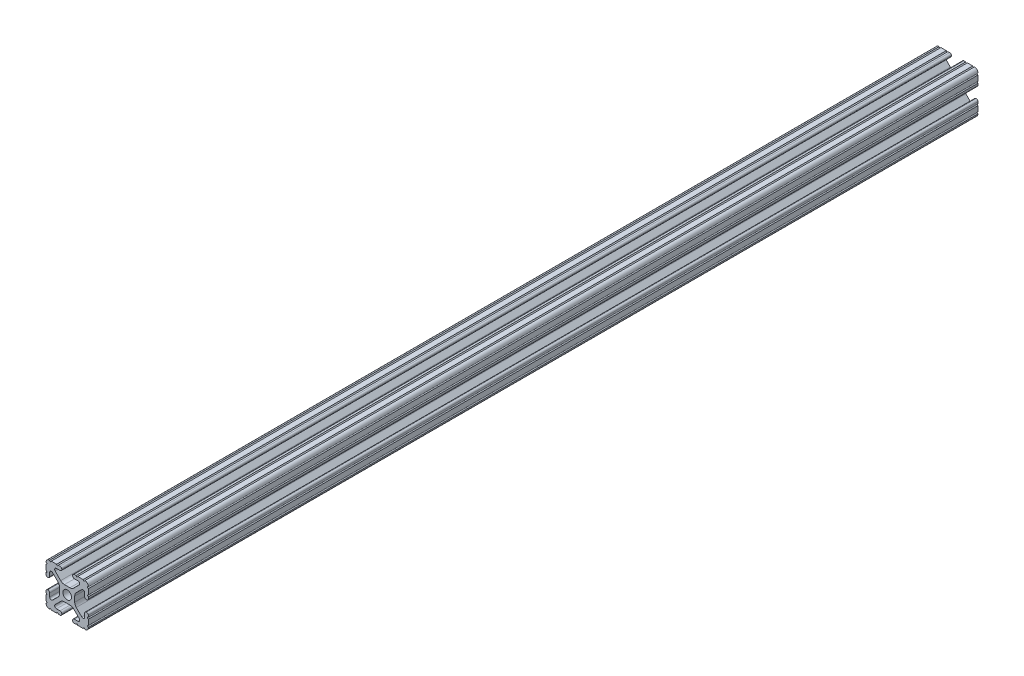
from build123d import *

# Parameters (mm, degrees)
SKETCH1_R      = 2.6035
EXTRUDE1_DEPTH = 533.4


with BuildPart() as part:
    # Sketch1 → Extrude1 (new body)
    with BuildSketch(Plane.XY):
        with BuildLine():
            Line((-7.207036008, 8.724370562), (-3.898272566, 5.423169045))
            ThreePointArc((-3.898272566, 5.423169045), (-2.869120213, 4.736787962), (-1.655778399, 4.4958))
            Line((-1.655778399, 4.4958), (1.655778399, 4.4958))
            ThreePointArc((1.655778399, 4.4958), (2.869120213, 4.736787962), (3.898272566, 5.423169045))
            Line((3.898272566, 5.423169045), (7.207036008, 8.724370562))
            ThreePointArc((7.207036008, 8.724370562), (7.432222385, 9.85140422), (6.476788598, 10.4902))
            Line((6.476788598, 10.4902), (4.287512407, 10.4902))
            ThreePointArc((4.287512407, 10.4902), (3.54574862, 10.79744862), (3.2385, 11.539212407))
            Line((3.2385, 11.539212407), (3.2385, 11.650987593))
            ThreePointArc((3.2385, 11.650987593), (3.54574862, 12.39275138), (4.287512407, 12.7))
            Line((4.287512407, 12.7), (5.317126718, 12.7))
            ThreePointArc((5.317126718, 12.7), (5.825126718, 12.192), (6.333126718, 12.7))
            Line((6.333126718, 12.7), (9.550443118, 12.7))
            ThreePointArc((9.550443118, 12.7), (10.058366869, 12.192000006), (10.566443095, 12.699847501))
            ThreePointArc((10.566443095, 12.699847501), (12.082537762, 12.08250727), (12.699846982, 10.566399977))
            ThreePointArc((12.699846982, 10.566399977), (12.192000006, 10.058323491), (12.7, 9.5504))
            Line((12.7, 9.5504), (12.7, 6.3330836))
            ThreePointArc((12.7, 6.3330836), (12.192, 5.8250836), (12.7, 5.3170836))
            Line((12.7, 5.3170836), (12.7, 4.287469289))
            ThreePointArc((12.7, 4.287469289), (12.39275138, 3.545705502), (11.650987593, 3.238456882))
            Line((11.650987593, 3.238456882), (11.539212407, 3.238456882))
            ThreePointArc((11.539212407, 3.238456882), (10.79744862, 3.545705502), (10.4902, 4.287469289))
            Line((10.4902, 4.287469289), (10.4902, 6.402089023))
            ThreePointArc((10.4902, 6.402089023), (9.856505071, 7.351067942), (8.737131347, 7.129408934))
            Line((8.737131347, 7.129408934), (5.441005833, 3.840816462))
            ThreePointArc((5.441005833, 3.840816462), (4.750877967, 2.809883091), (4.5085, 1.593185507))
            Line((4.5085, 1.593185507), (4.5085, -1.593185507))
            ThreePointArc((4.5085, -1.593185507), (4.750877967, -2.809883091), (5.441005833, -3.840816462))
            Line((5.441005833, -3.840816462), (8.737131347, -7.129408934))
            ThreePointArc((8.737131347, -7.129408934), (9.856505071, -7.351067942), (10.4902, -6.402089023))
            Line((10.4902, -6.402089023), (10.4902, -4.287469289))
            ThreePointArc((10.4902, -4.287469289), (10.79744862, -3.545705502), (11.539212407, -3.238456882))
            Line((11.539212407, -3.238456882), (11.650987593, -3.238456882))
            ThreePointArc((11.650987593, -3.238456882), (12.39275138, -3.545705502), (12.7, -4.287469289))
            Line((12.7, -4.287469289), (12.7, -5.3170836))
            ThreePointArc((12.7, -5.3170836), (12.192, -5.8250836), (12.7, -6.3330836))
            Line((12.7, -6.3330836), (12.7, -9.5504))
            ThreePointArc((12.7, -9.5504), (12.192000006, -10.058323491), (12.699846982, -10.566399977))
            ThreePointArc((12.699846982, -10.566399977), (12.082537762, -12.08250727), (10.566443095, -12.699847501))
            ThreePointArc((10.566443095, -12.699847501), (10.058366869, -12.192000006), (9.550443118, -12.7))
            Line((9.550443118, -12.7), (6.333126718, -12.7))
            ThreePointArc((6.333126718, -12.7), (5.825126718, -12.192), (5.317126718, -12.7))
            Line((5.317126718, -12.7), (4.287512407, -12.7))
            ThreePointArc((4.287512407, -12.7), (3.54574862, -12.39275138), (3.2385, -11.650987593))
            Line((3.2385, -11.650987593), (3.2385, -11.539212407))
            ThreePointArc((3.2385, -11.539212407), (3.54574862, -10.79744862), (4.287512407, -10.4902))
            Line((4.287512407, -10.4902), (6.416408329, -10.4902))
            ThreePointArc((6.416408329, -10.4902), (7.41473083, -9.822813117), (7.179650497, -8.645192506))
            Line((7.179650497, -8.645192506), (3.952270251, -5.423690499))
            ThreePointArc((3.952270251, -5.423690499), (2.922936451, -4.736929036), (1.709253557, -4.4958))
            Line((1.709253557, -4.4958), (-1.709253557, -4.4958))
            ThreePointArc((-1.709253557, -4.4958), (-2.922936451, -4.736929036), (-3.952270251, -5.423690499))
            Line((-3.952270251, -5.423690499), (-7.179650497, -8.645192506))
            ThreePointArc((-7.179650497, -8.645192506), (-7.41473083, -9.822813117), (-6.416408329, -10.4902))
            Line((-6.416408329, -10.4902), (-4.287512407, -10.4902))
            ThreePointArc((-4.287512407, -10.4902), (-3.54574862, -10.79744862), (-3.2385, -11.539212407))
            Line((-3.2385, -11.539212407), (-3.2385, -11.650987593))
            ThreePointArc((-3.2385, -11.650987593), (-3.54574862, -12.39275138), (-4.287512407, -12.7))
            Line((-4.287512407, -12.7), (-5.317126718, -12.7))
            ThreePointArc((-5.317126718, -12.7), (-5.825126718, -12.192), (-6.333126718, -12.7))
            Line((-6.333126718, -12.7), (-9.550443118, -12.7))
            ThreePointArc((-9.550443118, -12.7), (-10.058366869, -12.192000006), (-10.566443095, -12.699847501))
            ThreePointArc((-10.566443095, -12.699847501), (-12.082537762, -12.08250727), (-12.699846982, -10.566399977))
            ThreePointArc((-12.699846982, -10.566399977), (-12.192000006, -10.058323491), (-12.7, -9.5504))
            Line((-12.7, -9.5504), (-12.7, -6.3330836))
            ThreePointArc((-12.7, -6.3330836), (-12.192, -5.8250836), (-12.7, -5.3170836))
            Line((-12.7, -5.3170836), (-12.7, -4.287469289))
            ThreePointArc((-12.7, -4.287469289), (-12.39275138, -3.545705502), (-11.650987593, -3.238456882))
            Line((-11.650987593, -3.238456882), (-11.539212407, -3.238456882))
            ThreePointArc((-11.539212407, -3.238456882), (-10.79744862, -3.545705502), (-10.4902, -4.287469289))
            Line((-10.4902, -4.287469289), (-10.4902, -6.402089023))
            ThreePointArc((-10.4902, -6.402089023), (-9.856505071, -7.351067942), (-8.737131347, -7.129408934))
            Line((-8.737131347, -7.129408934), (-5.441005833, -3.840816462))
            ThreePointArc((-5.441005833, -3.840816462), (-4.750877967, -2.809883091), (-4.5085, -1.593185507))
            Line((-4.5085, -1.593185507), (-4.5085, 1.593185507))
            ThreePointArc((-4.5085, 1.593185507), (-4.750877967, 2.809883091), (-5.441005833, 3.840816462))
            Line((-5.441005833, 3.840816462), (-8.737131347, 7.129408934))
            ThreePointArc((-8.737131347, 7.129408934), (-9.856505071, 7.351067942), (-10.4902, 6.402089023))
            Line((-10.4902, 6.402089023), (-10.4902, 4.287469289))
            ThreePointArc((-10.4902, 4.287469289), (-10.79744862, 3.545705502), (-11.539212407, 3.238456882))
            Line((-11.539212407, 3.238456882), (-11.650987593, 3.238456882))
            ThreePointArc((-11.650987593, 3.238456882), (-12.39275138, 3.545705502), (-12.7, 4.287469289))
            Line((-12.7, 4.287469289), (-12.7, 5.3170836))
            ThreePointArc((-12.7, 5.3170836), (-12.192, 5.8250836), (-12.7, 6.3330836))
            Line((-12.7, 6.3330836), (-12.7, 9.5504))
            ThreePointArc((-12.7, 9.5504), (-12.192000006, 10.058323491), (-12.699846982, 10.566399977))
            ThreePointArc((-12.699846982, 10.566399977), (-12.082537762, 12.08250727), (-10.566443095, 12.699847501))
            ThreePointArc((-10.566443095, 12.699847501), (-10.058366869, 12.192000006), (-9.550443118, 12.7))
            Line((-9.550443118, 12.7), (-6.333126718, 12.7))
            ThreePointArc((-6.333126718, 12.7), (-5.825126718, 12.192), (-5.317126718, 12.7))
            Line((-5.317126718, 12.7), (-4.287512407, 12.7))
            ThreePointArc((-4.287512407, 12.7), (-3.54574862, 12.39275138), (-3.2385, 11.650987593))
            Line((-3.2385, 11.650987593), (-3.2385, 11.539212407))
            ThreePointArc((-3.2385, 11.539212407), (-3.54574862, 10.79744862), (-4.287512407, 10.4902))
            Line((-4.287512407, 10.4902), (-6.476788598, 10.4902))
            ThreePointArc((-6.476788598, 10.4902), (-7.432222385, 9.85140422), (-7.207036008, 8.724370562))
        make_face()
        Circle(SKETCH1_R, mode=Mode.SUBTRACT)
    extrude(amount=-EXTRUDE1_DEPTH)


solid = part.part
